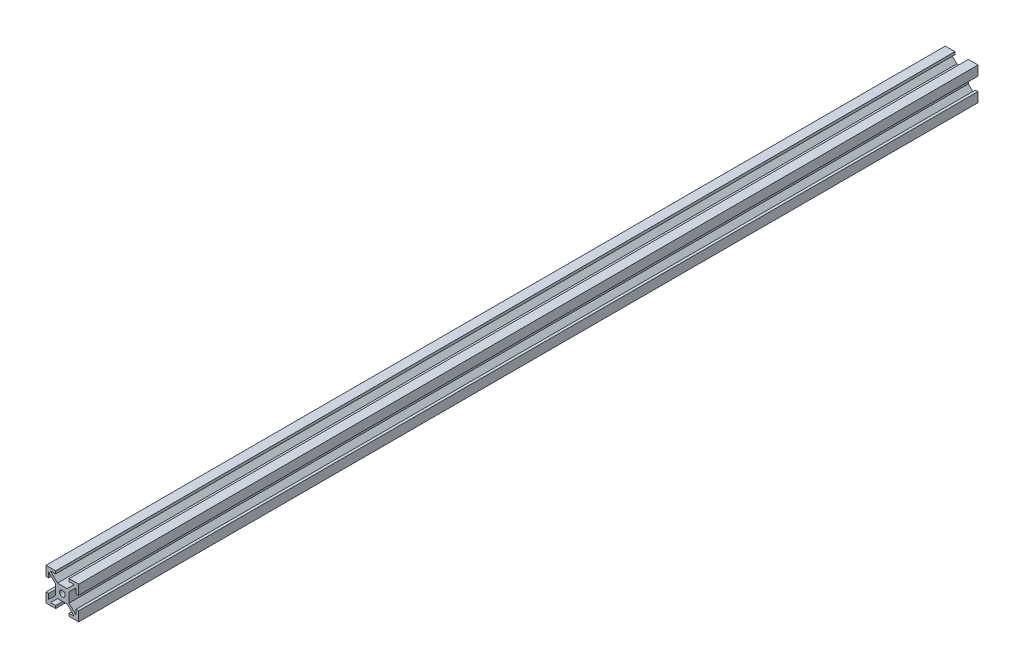
from build123d import *

# Parameters (mm, degrees)
SKETCH1_R           = 1.77
BOSS_EXTRUDE1_DEPTH = 550


with BuildPart() as part:
    # Sketch1 → Boss-Extrude1 (new body)
    with BuildSketch(Plane.XY):
        Polygon((-8.38, 4.1), (-10, 4.1), (-10, 10), (-4.1, 10), (-4.1, 8.38), (-7.234487014, 8.38), (-2.954487014, 4.1), (2.954487014, 4.1), (7.234487014, 8.38), (4.1, 8.38), (4.1, 10), (10, 10), (10, 4.1), (8.38, 4.1), (8.38, 7.234487014), (4.1, 2.954487014), (4.1, -2.954487014), (8.38, -7.234487014), (8.38, -4.1), (10, -4.1), (10, -10), (4.1, -10), (4.1, -8.38), (7.234487014, -8.38), (2.954487014, -4.1), (-2.954487014, -4.1), (-7.234487014, -8.38), (-4.1, -8.38), (-4.1, -10), (-10, -10), (-10, -4.1), (-8.38, -4.1), (-8.38, -7.234487014), (-4.1, -2.954487014), (-4.1, 2.954487014), (-8.38, 7.234487014), align=None)
        Circle(SKETCH1_R, mode=Mode.SUBTRACT)
    extrude(amount=BOSS_EXTRUDE1_DEPTH)


solid = part.part
